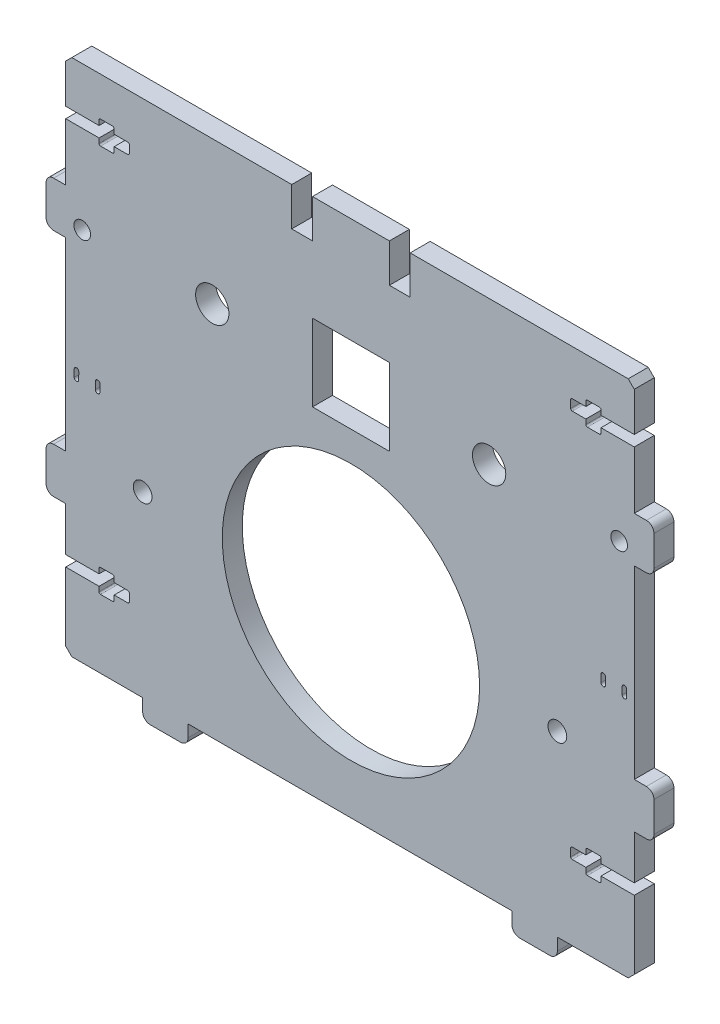
from build123d import *

# Parameters (mm, degrees)
MODEL_R             = 42.5
MODEL_R_2           = 5.5
MODEL_R_3           = 2.75
MODEL_R_4           = 3.1
MODEL_W             = 25.4
MODEL_H             = 25.4
BOSS_EXTRUDE1_DEPTH = 6.6


with BuildPart() as part:
    # Model → Boss-Extrude1 (new body)
    with BuildSketch(Plane.XY):
        with BuildLine():
            Line((187.8, 2), (187.8, 24.665))
            Line((187.8, 24.665), (176.8, 24.665))
            Line((176.8, 24.665), (176.8, 23.08))
            ThreePointArc((176.8, 23.08), (176.653553391, 22.726446609), (176.3, 22.58))
            Line((176.3, 22.58), (172.3, 22.58))
            ThreePointArc((172.3, 22.58), (171.946446609, 22.726446609), (171.8, 23.08))
            Line((171.8, 23.08), (171.8, 24.665))
            Line((171.8, 24.665), (167.3, 24.665))
            ThreePointArc((167.3, 24.665), (166.946446609, 24.811446609), (166.8, 25.165))
            Line((166.8, 25.165), (166.8, 27.715))
            ThreePointArc((166.8, 27.715), (166.946446609, 28.068553391), (167.3, 28.215))
            Line((167.3, 28.215), (171.8, 28.215))
            Line((171.8, 28.215), (171.8, 29.8))
            ThreePointArc((171.8, 29.8), (171.946446609, 30.153553391), (172.3, 30.3))
            Line((172.3, 30.3), (176.3, 30.3))
            ThreePointArc((176.3, 30.3), (176.653553391, 30.153553391), (176.8, 29.8))
            Line((176.8, 29.8), (176.8, 28.215))
            Line((176.8, 28.215), (187.8, 28.215))
            Line((187.8, 28.215), (187.8, 42.8))
            Line((187.8, 42.8), (191.8, 42.8))
            ThreePointArc((191.8, 42.8), (193.567766953, 43.532233047), (194.3, 45.3))
            Line((194.3, 45.3), (194.3, 55.3))
            ThreePointArc((194.3, 55.3), (193.567766953, 57.067766953), (191.8, 57.8))
            Line((191.8, 57.8), (187.8, 57.8))
            Line((187.8, 57.8), (187.8, 118.92))
            Line((187.8, 118.92), (191.8, 118.92))
            ThreePointArc((191.8, 118.92), (193.567766953, 119.652233047), (194.3, 121.42))
            Line((194.3, 121.42), (194.3, 131.42))
            ThreePointArc((194.3, 131.42), (193.567766953, 133.187766953), (191.8, 133.92))
            Line((191.8, 133.92), (187.8, 133.92))
            Line((187.8, 133.92), (187.8, 152.92))
            Line((187.8, 152.92), (176.8, 152.92))
            Line((176.8, 152.92), (176.8, 151.335))
            ThreePointArc((176.8, 151.335), (176.653553391, 150.981446609), (176.3, 150.835))
            Line((176.3, 150.835), (172.3, 150.835))
            ThreePointArc((172.3, 150.835), (171.946446609, 150.981446609), (171.8, 151.335))
            Line((171.8, 151.335), (171.8, 152.92))
            Line((171.8, 152.92), (167.3, 152.92))
            ThreePointArc((167.3, 152.92), (166.946446609, 153.066446609), (166.8, 153.42))
            Line((166.8, 153.42), (166.8, 155.97))
            ThreePointArc((166.8, 155.97), (166.946446609, 156.323553391), (167.3, 156.47))
            Line((167.3, 156.47), (171.8, 156.47))
            Line((171.8, 156.47), (171.8, 158.055))
            ThreePointArc((171.8, 158.055), (171.946446609, 158.408553391), (172.3, 158.555))
            Line((172.3, 158.555), (176.3, 158.555))
            ThreePointArc((176.3, 158.555), (176.653553391, 158.408553391), (176.8, 158.055))
            Line((176.8, 158.055), (176.8, 156.47))
            Line((176.8, 156.47), (187.8, 156.47))
            Line((187.8, 156.47), (187.8, 169.42))
            Line((187.8, 169.42), (185.8, 171.42))
            Line((185.8, 171.42), (113.770001664, 171.42))
            Line((113.770001664, 171.42), (113.770001664, 158.72))
            Line((113.770001664, 158.72), (106.910001664, 158.72))
            Line((106.910001664, 158.72), (106.910001664, 171.42))
            Line((106.910001664, 171.42), (81.510001665, 171.42))
            Line((81.510001665, 171.42), (81.510001665, 158.72))
            Line((81.510001665, 158.72), (74.650001665, 158.72))
            Line((74.650001665, 158.72), (74.650001665, 171.42))
            Line((74.650001665, 171.42), (2, 171.42))
            Line((2, 171.42), (0, 169.42))
            Line((0, 169.42), (0, 156.47))
            Line((0, 156.47), (11, 156.47))
            Line((11, 156.47), (11, 158.055))
            ThreePointArc((11, 158.055), (11.146446609, 158.408553391), (11.5, 158.555))
            Line((11.5, 158.555), (15.5, 158.555))
            ThreePointArc((15.5, 158.555), (15.853553391, 158.408553391), (16, 158.055))
            Line((16, 158.055), (16, 156.47))
            Line((16, 156.47), (20.5, 156.47))
            ThreePointArc((20.5, 156.47), (20.853553391, 156.323553391), (21, 155.97))
            Line((21, 155.97), (21, 153.42))
            ThreePointArc((21, 153.42), (20.853553391, 153.066446609), (20.5, 152.92))
            Line((20.5, 152.92), (16, 152.92))
            Line((16, 152.92), (16, 151.335))
            ThreePointArc((16, 151.335), (15.853553391, 150.981446609), (15.5, 150.835))
            Line((15.5, 150.835), (11.5, 150.835))
            ThreePointArc((11.5, 150.835), (11.146446609, 150.981446609), (11, 151.335))
            Line((11, 151.335), (11, 152.92))
            Line((11, 152.92), (0, 152.92))
            Line((0, 152.92), (0, 133.92))
            Line((0, 133.92), (-4, 133.92))
            ThreePointArc((-4, 133.92), (-5.767766953, 133.187766953), (-6.5, 131.42))
            Line((-6.5, 131.42), (-6.5, 121.42))
            ThreePointArc((-6.5, 121.42), (-5.767766953, 119.652233047), (-4, 118.92))
            Line((-4, 118.92), (0, 118.92))
            Line((0, 118.92), (0, 57.8))
            Line((0, 57.8), (-4, 57.8))
            ThreePointArc((-4, 57.8), (-5.767766953, 57.067766953), (-6.5, 55.3))
            Line((-6.5, 55.3), (-6.5, 45.3))
            ThreePointArc((-6.5, 45.3), (-5.767766953, 43.532233047), (-4, 42.8))
            Line((-4, 42.8), (0, 42.8))
            Line((0, 42.8), (0, 28.215))
            Line((0, 28.215), (11, 28.215))
            Line((11, 28.215), (11, 29.8))
            ThreePointArc((11, 29.8), (11.146446609, 30.153553391), (11.5, 30.3))
            Line((11.5, 30.3), (15.5, 30.3))
            ThreePointArc((15.5, 30.3), (15.853553391, 30.153553391), (16, 29.8))
            Line((16, 29.8), (16, 28.215))
            Line((16, 28.215), (20.5, 28.215))
            ThreePointArc((20.5, 28.215), (20.853553391, 28.068553391), (21, 27.715))
            Line((21, 27.715), (21, 25.165))
            ThreePointArc((21, 25.165), (20.853553391, 24.811446609), (20.5, 24.665))
            Line((20.5, 24.665), (16, 24.665))
            Line((16, 24.665), (16, 23.08))
            ThreePointArc((16, 23.08), (15.853553391, 22.726446609), (15.5, 22.58))
            Line((15.5, 22.58), (11.5, 22.58))
            ThreePointArc((11.5, 22.58), (11.146446609, 22.726446609), (11, 23.08))
            Line((11, 23.08), (11, 24.665))
            Line((11, 24.665), (0, 24.665))
            Line((0, 24.665), (0, 2))
            Line((0, 2), (2, 0))
            Line((2, 0), (25.4, 0))
            Line((25.4, 0), (25.4, -4))
            ThreePointArc((25.4, -4), (26.132233047, -5.767766953), (27.9, -6.5))
            Line((27.9, -6.5), (37.9, -6.5))
            ThreePointArc((37.9, -6.5), (39.667766953, -5.767766953), (40.4, -4))
            Line((40.4, -4), (40.4, 0))
            Line((40.4, 0), (147.4, 0))
            Line((147.4, 0), (147.4, -4))
            ThreePointArc((147.4, -4), (148.132233047, -5.767766953), (149.9, -6.5))
            Line((149.9, -6.5), (159.9, -6.5))
            ThreePointArc((159.9, -6.5), (161.667766953, -5.767766953), (162.4, -4))
            Line((162.4, -4), (162.4, 0))
            Line((162.4, 0), (185.8, 0))
            Line((185.8, 0), (187.8, 2))
        make_face()
        with Locations((94.21, 58.872106781)):
            Circle(MODEL_R, mode=Mode.SUBTRACT)
        with Locations((139.852001664, 123.924806781)):
            Circle(MODEL_R_2, mode=Mode.SUBTRACT)
        with Locations((48.39651697, 124.09019794)):
            Circle(MODEL_R_2, mode=Mode.SUBTRACT)
        with Locations((182.8, 123.5)):
            Circle(MODEL_R_3, mode=Mode.SUBTRACT)
        with Locations((5.447263086, 123.820730625)):
            Circle(MODEL_R_3, mode=Mode.SUBTRACT)
        with Locations((162.4, 58.872106781)):
            Circle(MODEL_R_4, mode=Mode.SUBTRACT)
        with Locations((25.4, 58.872106781)):
            Circle(MODEL_R_4, mode=Mode.SUBTRACT)
        with Locations((94.210001664, 123.924806781)):
            Rectangle(MODEL_W, MODEL_H, mode=Mode.SUBTRACT)
        with BuildLine():
            Line((183.8, 82.4), (183.8, 80))
            ThreePointArc((183.8, 80), (184.55, 79.25), (185.3, 80))
            Line((185.3, 80), (185.3, 82.4))
            ThreePointArc((185.3, 82.4), (184.55, 83.15), (183.8, 82.4))
        make_face(mode=Mode.SUBTRACT)
        with BuildLine():
            Line((176.8, 82.4), (176.8, 80))
            ThreePointArc((176.8, 80), (177.55, 79.25), (178.3, 80))
            Line((178.3, 80), (178.3, 82.4))
            ThreePointArc((178.3, 82.4), (177.55, 83.15), (176.8, 82.4))
        make_face(mode=Mode.SUBTRACT)
        with BuildLine():
            Line((9.798580907, 82.704723605), (9.789900455, 80.304739303))
            ThreePointArc((9.789900455, 80.304739303), (10.537182908, 79.552031568), (11.289890644, 80.299314021))
            Line((11.289890644, 80.299314021), (11.298571096, 82.699298323))
            ThreePointArc((11.298571096, 82.699298323), (10.551288643, 83.452006058), (9.798580907, 82.704723605))
        make_face(mode=Mode.SUBTRACT)
        with BuildLine():
            Line((2.798626693, 82.730041591), (2.789946241, 80.330057289))
            ThreePointArc((2.789946241, 80.330057289), (3.537228694, 79.577349553), (4.28993643, 80.324632006))
            Line((4.28993643, 80.324632006), (4.298616882, 82.724616308))
            ThreePointArc((4.298616882, 82.724616308), (3.551334429, 83.477324044), (2.798626693, 82.730041591))
        make_face(mode=Mode.SUBTRACT)
    extrude(amount=BOSS_EXTRUDE1_DEPTH)


solid = part.part
